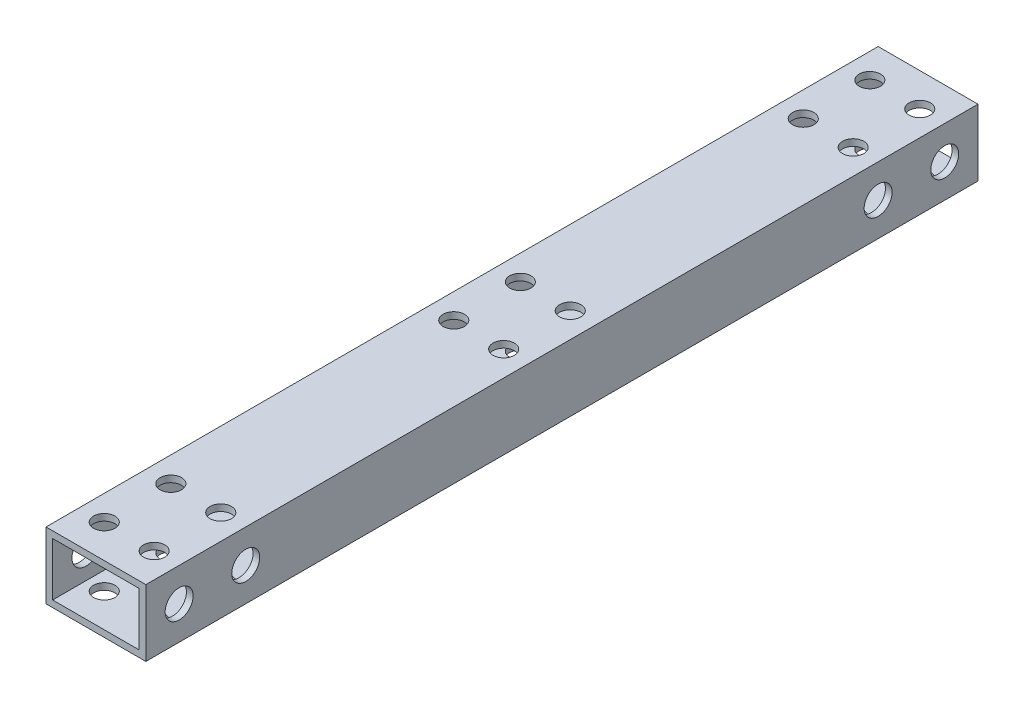
from build123d import *

# Parameters (mm, degrees)
SKETCH_1_W          = 15
SKETCH_1_H          = 10
SKETCH_1_W_2        = 13
SKETCH_1_H_2        = 8
EXTRUDE_1_DEPTH     = 125
SKETCH_2_R          = 2.1
CUT_EXTRUDE_1_DEPTH = 127.293309403
SKETCH_3_R          = 1.6
CUT_EXTRUDE_2_DEPTH = 127.293309403


with BuildPart() as part:
    # 草图1 → 拉伸-薄壁1 (new body)
    with BuildSketch(Plane.XY):
        with Locations((7.5, -5)):
            Rectangle(SKETCH_1_W, SKETCH_1_H)
        with Locations((7.5, -5)):
            Rectangle(SKETCH_1_W_2, SKETCH_1_H_2, mode=Mode.SUBTRACT)
    extrude(amount=EXTRUDE_1_DEPTH)

    # 草图2 → 切除-拉伸1 (cut, through all)
    with BuildSketch(Plane(origin=(15, 0, 0), x_dir=(0, 0, -1), z_dir=(1, 0, 0))):
        with Locations(Location((-120, -5, 0), (0, 0, 90))):
            Circle(SKETCH_2_R)
        with Locations(Location((-110, -5, 0), (0, 0, 270))):
            Circle(SKETCH_2_R)
        with Locations(Location((-15, -5, 0), (0, 0, 90))):
            Circle(SKETCH_2_R)
        with Locations(Location((-5, -5, 0), (0, 0, 270))):
            Circle(SKETCH_2_R)
    extrude(amount=-CUT_EXTRUDE_1_DEPTH, mode=Mode.SUBTRACT)

    # 草图3 → 切除-拉伸2 (cut, through all)
    with BuildSketch(Plane.XZ.offset(10)):
        with Locations(Location((3.75, 67.5, 0), (0, 0, 270))):
            Circle(SKETCH_3_R)
        with Locations(Location((11.25, 67.5, 0), (0, 0, 270))):
            Circle(SKETCH_3_R)
        with Locations(Location((11.25, 57.5, 0), (0, 0, 270))):
            Circle(SKETCH_3_R)
        with Locations(Location((3.75, 57.5, 0), (0, 0, 270))):
            Circle(SKETCH_3_R)
        with Locations(Location((3.75, 120, 0), (0, 0, 270))):
            Circle(SKETCH_3_R)
        with Locations(Location((11.25, 120, 0), (0, 0, 270))):
            Circle(SKETCH_3_R)
        with Locations(Location((11.25, 110, 0), (0, 0, 270))):
            Circle(SKETCH_3_R)
        with Locations(Location((3.75, 110, 0), (0, 0, 270))):
            Circle(SKETCH_3_R)
        with Locations(Location((3.75, 15, 0), (0, 0, 270))):
            Circle(SKETCH_3_R)
        with Locations(Location((11.25, 15, 0), (0, 0, 270))):
            Circle(SKETCH_3_R)
        with Locations(Location((11.25, 5, 0), (0, 0, 270))):
            Circle(SKETCH_3_R)
        with Locations(Location((3.75, 5, 0), (0, 0, 270))):
            Circle(SKETCH_3_R)
    extrude(amount=-CUT_EXTRUDE_2_DEPTH, mode=Mode.SUBTRACT)


solid = part.part
